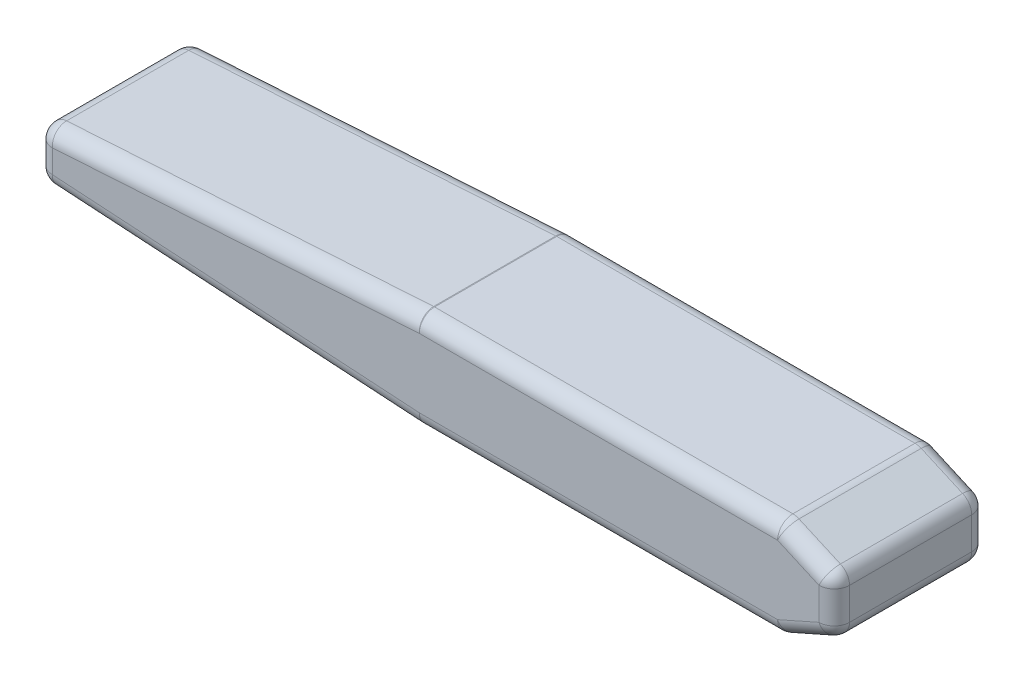
from build123d import *

# Parameters (mm, degrees)
BOSS_EXTRUDE1_DEPTH = 10
FILLET1_R           = 1


with BuildPart() as part:
    # Sketch1 → Boss-Extrude1 (new body)
    with BuildSketch(Plane.XY):
        with BuildLine():
            Line((0, 1.049183312), (0, -1.049183312))
            ThreePointArc((0, -1.049183312), (-0.161869295, -1.594652762), (-0.595073842, -1.963532701))
            Line((-0.595073842, -1.963532701), (-3.306595396, -3.16434939))
            ThreePointArc((-3.306595396, -3.16434939), (-3.504578796, -3.228353052), (-3.711521554, -3.25))
            Line((-3.711521554, -3.25), (-27.169029734, -3.25))
            ThreePointArc((-27.169029734, -3.25), (-27.199985158, -3.249520766), (-27.230910912, -3.248083523))
            Line((-27.230910912, -3.248083523), (-51.261881178, -1.758163367))
            ThreePointArc((-51.261881178, -1.758163367), (-51.928656702, -1.444958965), (-52.2, -0.760079844))
            Line((-52.2, -0.760079844), (-52.2, 0.760079844))
            ThreePointArc((-52.2, 0.760079844), (-51.928656702, 1.444958965), (-51.261881178, 1.758163367))
            Line((-51.261881178, 1.758163367), (-27.230910912, 3.248083523))
            ThreePointArc((-27.230910912, 3.248083523), (-27.199985158, 3.249520766), (-27.169029734, 3.25))
            Line((-27.169029734, 3.25), (-3.711521554, 3.25))
            ThreePointArc((-3.711521554, 3.25), (-3.504578796, 3.228353052), (-3.306595396, 3.16434939))
            Line((-3.306595396, 3.16434939), (-0.595073842, 1.963532701))
            ThreePointArc((-0.595073842, 1.963532701), (-0.161869295, 1.594652762), (0, 1.049183312))
        make_face()
    extrude(amount=BOSS_EXTRUDE1_DEPTH)

    # Fillet1
    fillet1_edges = [part.edges().sort_by_distance(p)[0] for p in [
        (-3.504578796, -3.228353052, 10),
        (-1.950834619, -2.563941045, 10),
        (-39.246396045, -2.503123445, 0),
        (-51.928656702, -1.444958965, 0),
        (-52.2, 0, 0),
        (-51.928656702, 1.444958965, 0),
        (-39.246396045, 2.503123445, 0),
        (-0.161869295, -1.594652762, 10),
        (-27.199985158, 3.249520766, 0),
        (-15.440275644, 3.25, 0),
        (-3.504578796, 3.228353052, 0),
        (-1.950834619, 2.563941045, 0),
        (-0.161869295, 1.594652762, 0),
        (0, 0, 0),
        (-0.161869295, -1.594652762, 0),
        (-1.950834619, -2.563941045, 0),
        (0, 0, 10),
        (-3.504578796, -3.228353052, 0),
        (-15.440275644, -3.25, 0),
        (-27.199985158, -3.249520766, 0),
        (-0.161869295, 1.594652762, 10),
        (-1.950834619, 2.563941045, 10),
        (-3.504578796, 3.228353052, 10),
        (-15.440275644, 3.25, 10),
        (-27.199985158, 3.249520766, 10),
        (-39.246396045, 2.503123445, 10),
        (-27.199985158, -3.249520766, 10),
        (-51.928656702, 1.444958965, 10),
        (-52.2, 0, 10),
        (-51.928656702, -1.444958965, 10),
        (-39.246396045, -2.503123445, 10),
        (-15.440275644, -3.25, 10),
    ]]
    fillet(fillet1_edges, radius=FILLET1_R)


solid = part.part
